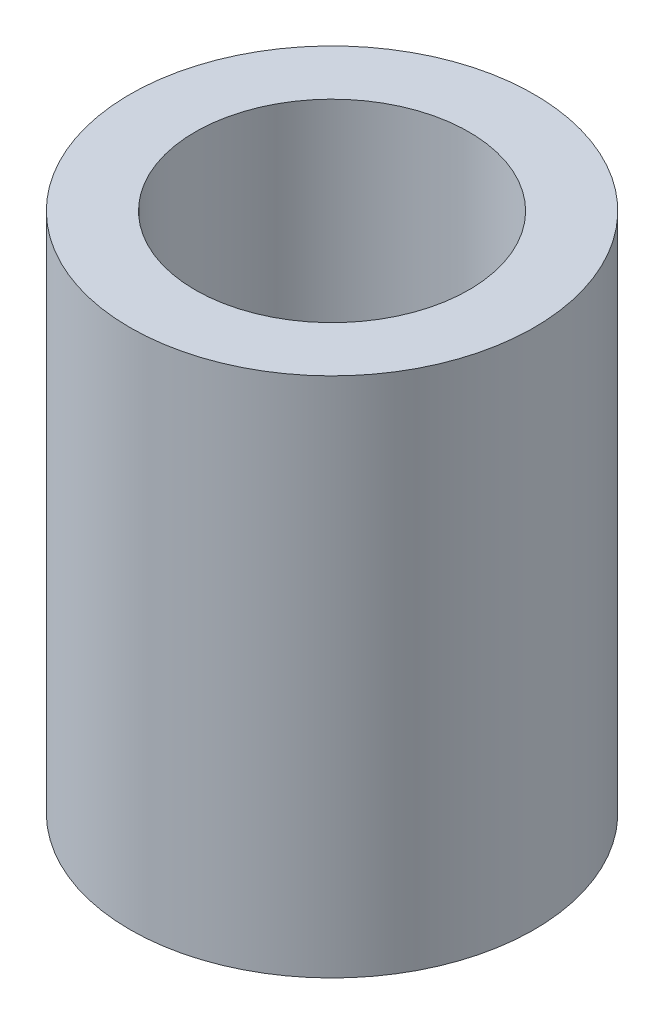
from build123d import *

# Parameters (mm, degrees)
SKETCH1_R           = 3.1
BOSS_EXTRUDE1_DEPTH = 8
SKETCH2_R           = 2.1
CUT_EXTRUDE1_DEPTH  = 10.122499657


with BuildPart() as part:
    # Sketch1 → Boss-Extrude1 (new body)
    with BuildSketch(Plane(origin=(0, 0, 0), x_dir=(1, 0, 0), z_dir=(0, 1, 0))):
        with Locations(Location((0, 0, 0), (0, 0, 270))):
            Circle(SKETCH1_R)
    extrude(amount=BOSS_EXTRUDE1_DEPTH)

    # Sketch2 → Cut-Extrude1 (cut, through all)
    with BuildSketch(Plane(origin=(0, 8, 0), x_dir=(1, 0, 0), z_dir=(0, 1, 0))):
        with Locations(Location((0, 0, 0), (0, 0, 270))):
            Circle(SKETCH2_R)
    extrude(amount=-CUT_EXTRUDE1_DEPTH, mode=Mode.SUBTRACT)


solid = part.part
